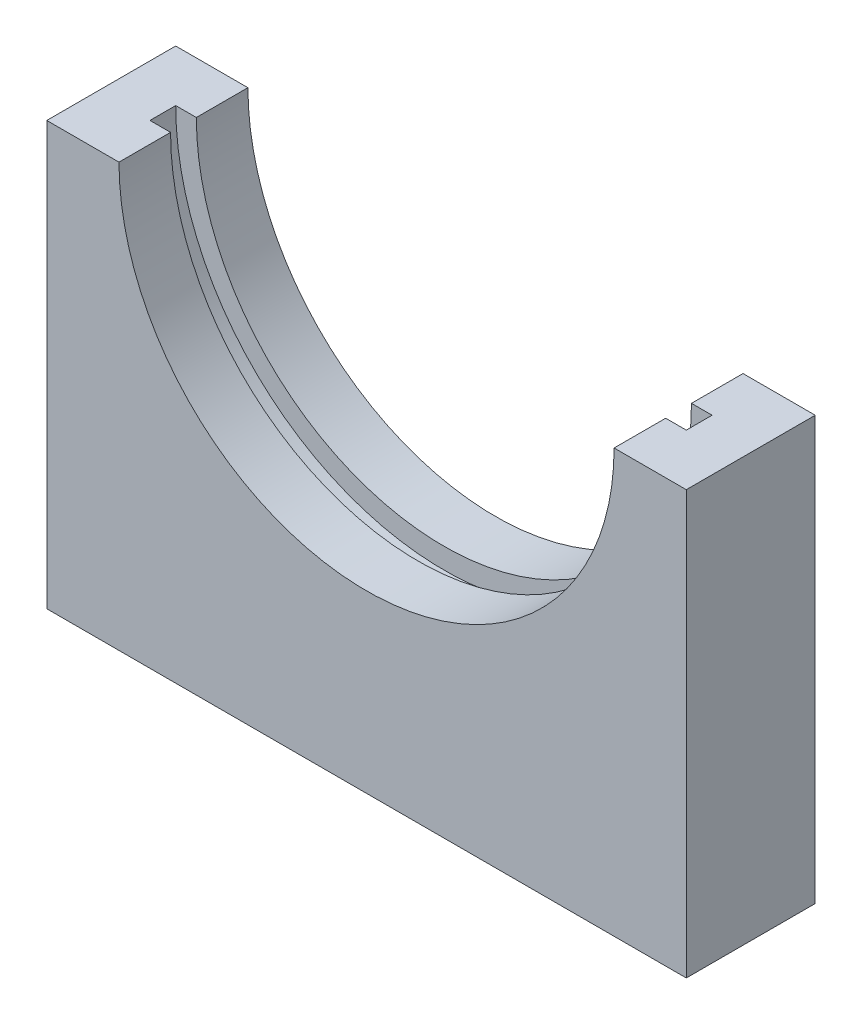
from build123d import *

# Parameters (mm, degrees)
BOSS_EXTRUDE2_DEPTH = 2.5
BOSS_EXTRUDE3_DEPTH = 5
BOSS_EXTRUDE4_START = 5
BOSS_EXTRUDE4_DEPTH = 5
SKETCH4_R           = 2.75
CUT_EXTRUDE1_DEPTH  = 10


with BuildPart() as part:
    # Sketch1 → Boss-Extrude2 (new body)
    with BuildSketch(Plane.XY):
        with BuildLine():
            ThreePointArc((-26, 0), (0, -26), (26, 0))
            Line((26, 0), (31, 0))
            Line((31, 0), (31, -41))
            Line((31, -41), (-31, -41))
            Line((-31, -41), (-31, 0))
            Line((-31, 0), (-26, 0))
        make_face()
    extrude(amount=BOSS_EXTRUDE2_DEPTH)

    # Sketch2 → Boss-Extrude3 (add)
    with BuildSketch(Plane.XY.offset(2.5)):
        with BuildLine():
            Line((-24, 0), (-31, 0))
            Line((-31, 0), (-31, -41))
            Line((-31, -41), (31, -41))
            Line((31, -41), (31, 0))
            Line((31, 0), (24, 0))
            ThreePointArc((24, 0), (0, -24), (-24, 0))
        make_face()
    extrude(amount=BOSS_EXTRUDE3_DEPTH)

    # Sketch3 → Boss-Extrude4 (add)
    with BuildSketch(Plane(origin=(0, 0, 0), x_dir=(-1, 0, 0), z_dir=(0, 0, -1)).offset(BOSS_EXTRUDE4_START)):
        with BuildLine():
            Line((-24, 0), (-31, 0))
            Line((-31, 0), (-31, -41))
            Line((-31, -41), (31, -41))
            Line((31, -41), (31, 0))
            Line((31, 0), (24, 0))
            ThreePointArc((24, 0), (0, -24), (-24, 0))
        make_face()
    extrude(amount=-BOSS_EXTRUDE4_DEPTH)

    # Sketch4 → Cut-Extrude1 (cut)
    with BuildSketch(Plane(origin=(0, -41, 0), x_dir=(-1, 0, 0), z_dir=(0, -1, 0))):
        with Locations(Location((0, -1.25, 0), (0, 0, 90))):
            Circle(SKETCH4_R)
    extrude(amount=-CUT_EXTRUDE1_DEPTH, mode=Mode.SUBTRACT)


solid = part.part
